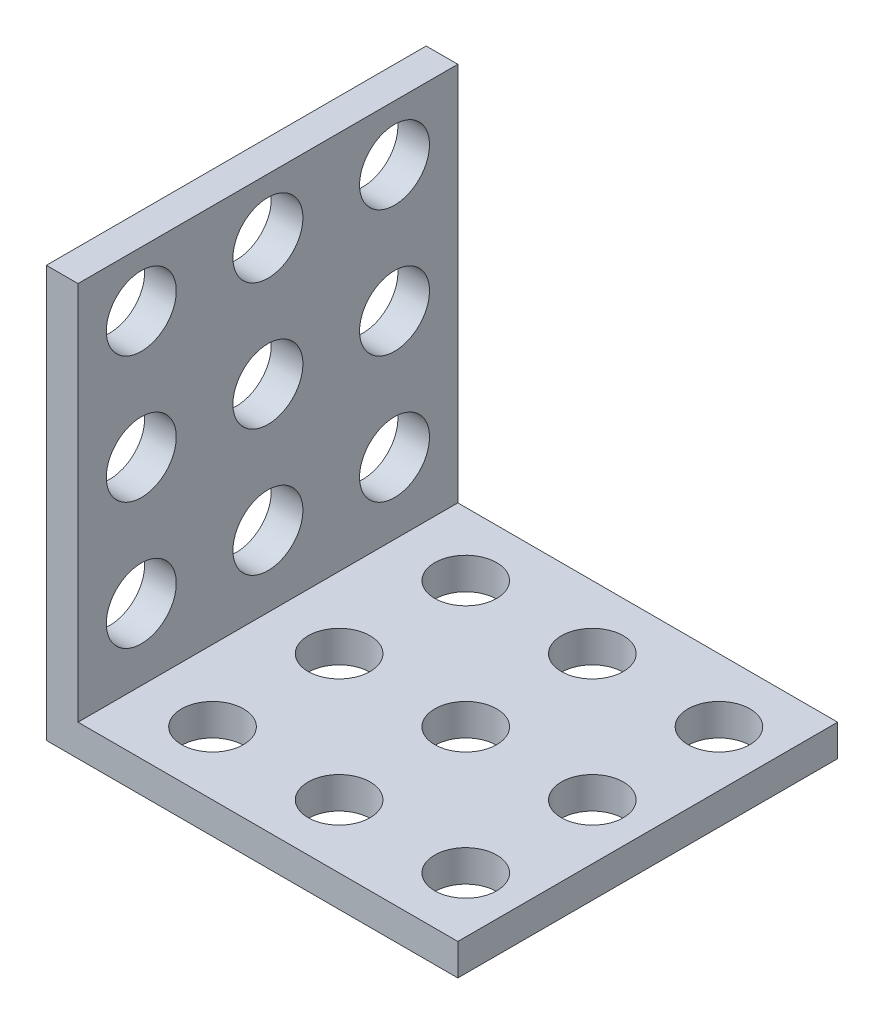
from build123d import *

# Parameters (mm, degrees)
SKETCH_1_W          = 26
SKETCH_1_H          = 24
SKETCH_1_R          = 1.959448434
EXTRUDE_1_DEPTH     = 26
SKETCH_2_W          = 24
SKETCH_2_H          = 24
CUT_EXTRUDE_1_DEPTH = 24
SKETCH_3_R          = 2.210837502
CUT_EXTRUDE_2_DEPTH = 24


with BuildPart() as part:
    # 草图1 → 凸台-拉伸1 (new body)
    with BuildSketch(Plane(origin=(0, 0, 0), x_dir=(1, 0, 0), z_dir=(0, 1, 0))):
        with Locations((0.263585178, -0.243309395)):
            Rectangle(SKETCH_1_W, SKETCH_1_H)
        with Locations(Location((9.763585178, -8.243309395, 0), (0, 0, 90))):
            Circle(SKETCH_1_R, mode=Mode.SUBTRACT)
        with Locations(Location((9.763585178, -0.243309395, 0), (0, 0, 90))):
            Circle(SKETCH_1_R, mode=Mode.SUBTRACT)
        with Locations(Location((9.763585178, 7.756690605, 0), (0, 0, 90))):
            Circle(SKETCH_1_R, mode=Mode.SUBTRACT)
        with Locations(Location((1.763585178, -8.243309395, 0), (0, 0, 90))):
            Circle(SKETCH_1_R, mode=Mode.SUBTRACT)
        with Locations(Location((1.763585178, -0.243309395, 0), (0, 0, 90))):
            Circle(SKETCH_1_R, mode=Mode.SUBTRACT)
        with Locations(Location((1.763585178, 7.756690605, 0), (0, 0, 90))):
            Circle(SKETCH_1_R, mode=Mode.SUBTRACT)
        with Locations(Location((-6.236414822, -8.243309395, 0), (0, 0, 90))):
            Circle(SKETCH_1_R, mode=Mode.SUBTRACT)
        with Locations(Location((-6.236414822, -0.243309395, 0), (0, 0, 90))):
            Circle(SKETCH_1_R, mode=Mode.SUBTRACT)
        with Locations(Location((-6.236414822, 7.756690605, 0), (0, 0, 90))):
            Circle(SKETCH_1_R, mode=Mode.SUBTRACT)
    extrude(amount=EXTRUDE_1_DEPTH)

    # 草图2 → 切除-拉伸1 (cut)
    with BuildSketch(Plane(origin=(0, 26, 0), x_dir=(1, 0, 0), z_dir=(0, 1, 0))):
        with Locations((1.263585178, -0.243309395)):
            Rectangle(SKETCH_2_W, SKETCH_2_H)
    extrude(amount=-CUT_EXTRUDE_1_DEPTH, mode=Mode.SUBTRACT)

    # 草图3 → 切除-拉伸2 (cut)
    with BuildSketch(Plane.ZY.offset(12.736414822)):
        with Locations((-7.756690605, 22.5)):
            Circle(SKETCH_3_R)
        with Locations((0.243309395, 22.5)):
            Circle(SKETCH_3_R)
        with Locations((8.243309395, 22.5)):
            Circle(SKETCH_3_R)
        with Locations((-7.756690605, 14.5)):
            Circle(SKETCH_3_R)
        with Locations((0.243309395, 14.5)):
            Circle(SKETCH_3_R)
        with Locations((8.243309395, 14.5)):
            Circle(SKETCH_3_R)
        with Locations((-7.756690605, 6.5)):
            Circle(SKETCH_3_R)
        with Locations((0.243309395, 6.5)):
            Circle(SKETCH_3_R)
        with Locations((8.243309395, 6.5)):
            Circle(SKETCH_3_R)
    extrude(amount=-CUT_EXTRUDE_2_DEPTH, mode=Mode.SUBTRACT)


solid = part.part
